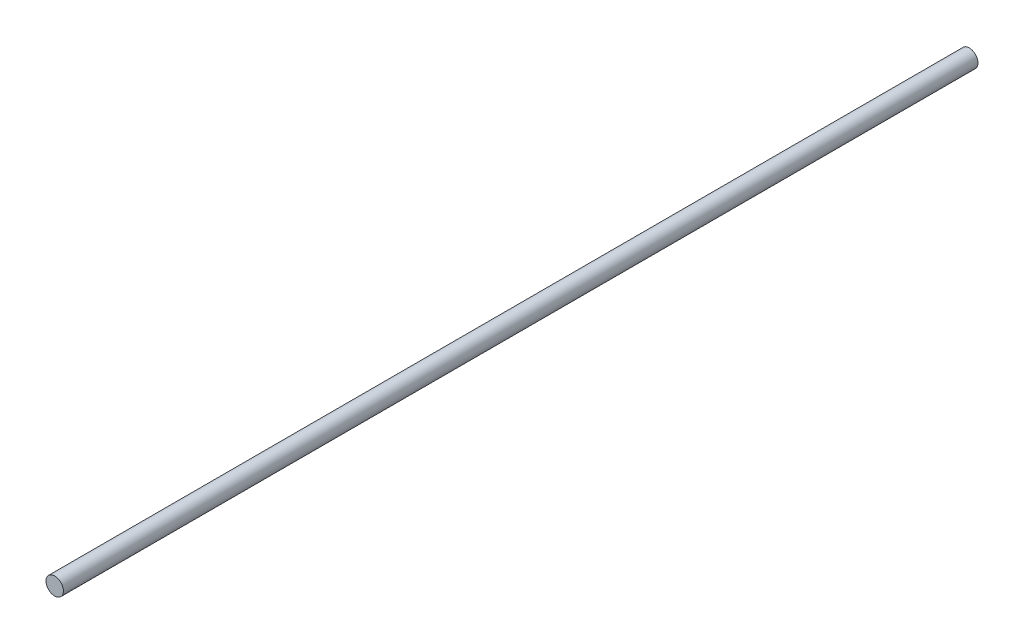
from build123d import *

# Parameters (mm, degrees)
SKETCH1_R           = 4
BOSS_EXTRUDE1_DEPTH = 210


with BuildPart() as part:
    # Sketch1 → Boss-Extrude1 (new, symmetric)
    with BuildSketch(Plane.XY):
        Circle(SKETCH1_R)
    extrude(amount=BOSS_EXTRUDE1_DEPTH, both=True)


solid = part.part
